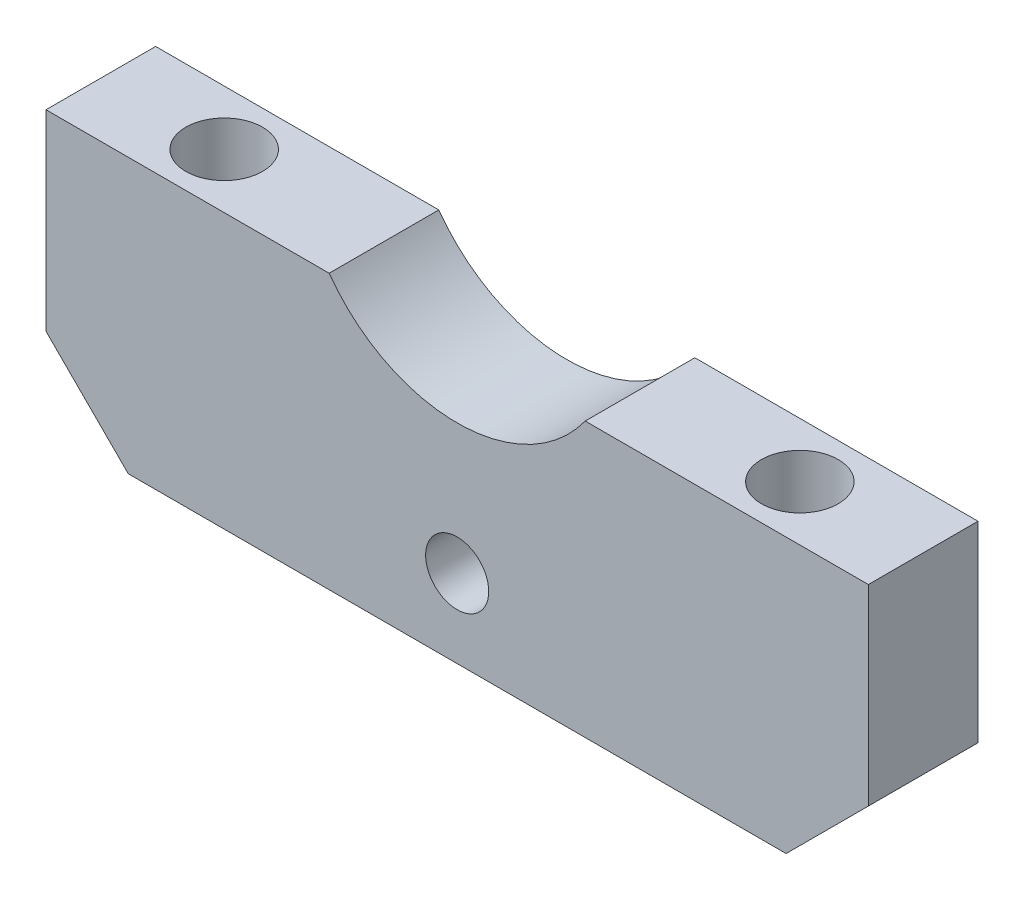
from build123d import *

# Parameters (mm, degrees)
SKETCH_1_W          = 30
SKETCH_1_H          = 13
EXTRUDE_1_DEPTH     = 4
SKETCH_3_R          = 5.75
CUT_EXTRUDE_2_DEPTH = 10
SKETCH_7_W          = 30
SKETCH_7_H          = 3
CUT_EXTRUDE_3_DEPTH = 10
CHAMFER_1_SIZE      = 3
SKETCH_8_R          = 1.4
CUT_EXTRUDE_4_DEPTH = 19.466185313
SKETCH_5_R          = 1.15
CUT_EXTRUDE_5_DEPTH = 10


with BuildPart() as part:
    # 草图1 → 凸台-拉伸1 (new body)
    with BuildSketch(Plane.XY):
        Rectangle(SKETCH_1_W, SKETCH_1_H)
    extrude(amount=EXTRUDE_1_DEPTH)

    # 草图3 → 切除-拉伸2 (cut)
    with BuildSketch(Plane.XY.offset(4)):
        with Locations((0, 9.854101966)):
            Circle(SKETCH_3_R)
    extrude(amount=-CUT_EXTRUDE_2_DEPTH, mode=Mode.SUBTRACT)

    # 草图7 → 切除-拉伸3 (cut)
    with BuildSketch(Plane.XY.offset(4)):
        with Locations((0, -5)):
            Rectangle(SKETCH_7_W, SKETCH_7_H)
    extrude(amount=-CUT_EXTRUDE_3_DEPTH, mode=Mode.SUBTRACT)

    # 倒角1
    chamfer_1_edges = [part.edges().sort_by_distance(p)[0] for p in [
        (-15, -3.5, 2),
        (15, -3.5, 2),
    ]]
    chamfer(chamfer_1_edges, length=CHAMFER_1_SIZE)

    # 草图8 → 切除-拉伸4 (cut, through all)
    with BuildSketch(Plane.XZ.offset(3.5)):
        with Locations(Location((-10.5, 2, 0), (0, 0, 270))):
            Circle(SKETCH_8_R)
    cut_extrude_4 = extrude(amount=-CUT_EXTRUDE_4_DEPTH, mode=Mode.SUBTRACT)

    # 镜向1: 切除-拉伸4 across plane
    add(cut_extrude_4.mirror(Plane(origin=(0, 0, 0), x_dir=(0, 0, 1), z_dir=(1, 0, 0))), mode=Mode.SUBTRACT)

    # 草图5 → 切除-拉伸5 (cut)
    with BuildSketch(Plane.XY.offset(4)):
        with Locations((0, -0.645898034)):
            Circle(SKETCH_5_R)
    extrude(amount=-CUT_EXTRUDE_5_DEPTH, mode=Mode.SUBTRACT)


solid = part.part
